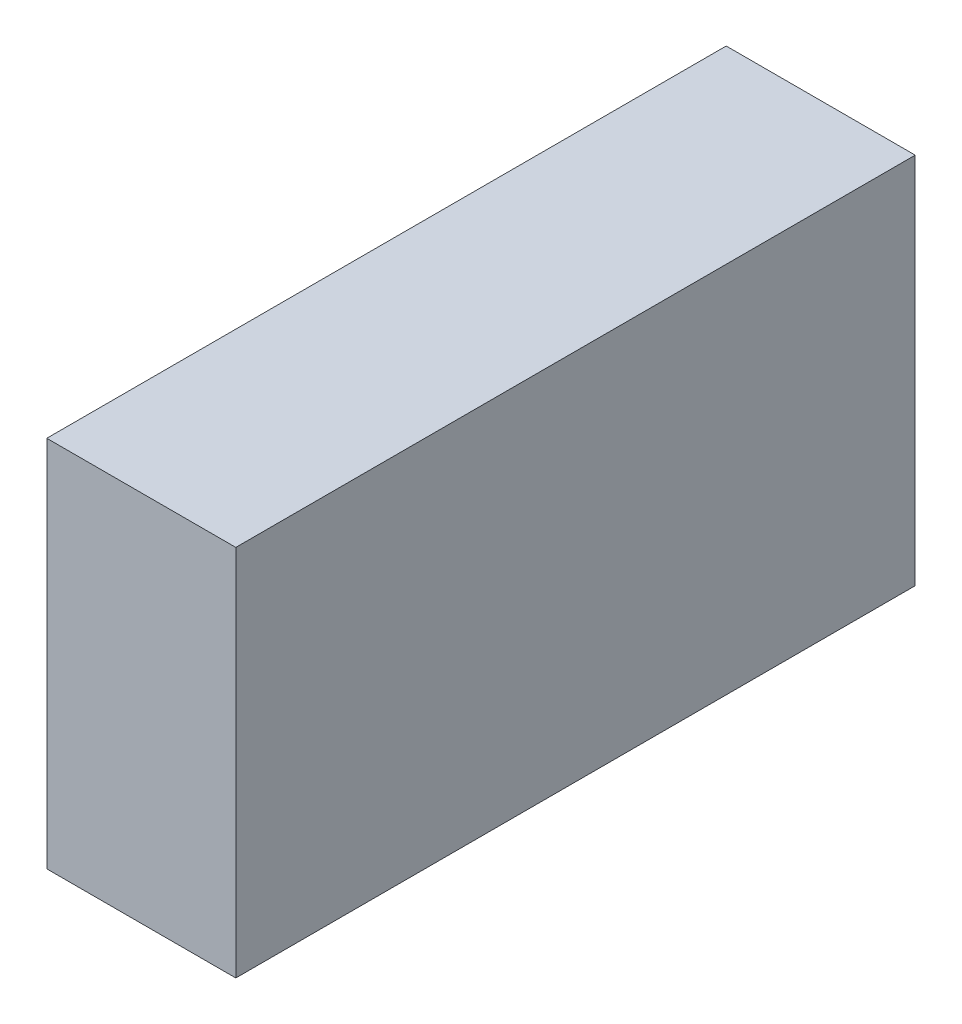
from build123d import *

# Parameters (mm, degrees)
SKETCH_1_W      = 66.5
SKETCH_1_H      = 36.5
EXTRUDE_1_DEPTH = 18.5


with BuildPart() as part:
    # 草图1 → 凸台-拉伸1 (new body)
    with BuildSketch(Plane(origin=(0, 0, 0), x_dir=(0, 0, -1), z_dir=(1, 0, 0))):
        with Locations((-104.630560492, 47.1916666)):
            Rectangle(SKETCH_1_W, SKETCH_1_H)
    extrude(amount=EXTRUDE_1_DEPTH)


solid = part.part
